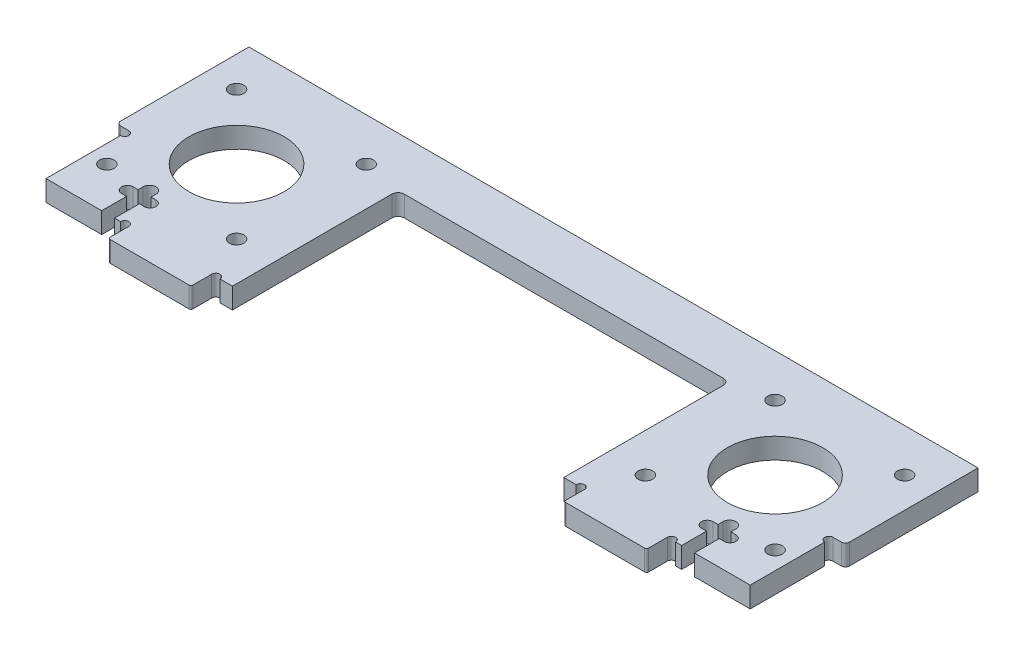
from build123d import *

# Parameters (mm, degrees)
SKETCH_1_W          = 170
SKETCH_1_H          = 52
EXTRUDE_1_DEPTH     = 5
SKETCH_2_R          = 11.5
SKETCH_2_R_2        = 1.75
CUT_EXTRUDE_1_DEPTH = 5
SKETCH_3_W          = 20
SKETCH_3_H          = 5
EXTRUDE_2_DEPTH     = 5
SKETCH_4_R          = 1
CUT_EXTRUDE_2_DEPTH = 5
CUT_EXTRUDE_3_DEPTH = 10
FILLET_1_R          = 0.5
SKETCH_7_W          = 3
SKETCH_7_H          = 32
EXTRUDE_3_DEPTH     = 5
SKETCH_8_R          = 1
CUT_EXTRUDE_5_DEPTH = 5
SKETCH_9_W          = 80
SKETCH_9_H          = 40
CUT_EXTRUDE_6_DEPTH = 10
FILLET_2_R          = 1.5
FILLET_3_R          = 1


with BuildPart() as part:
    # 스케치1 → 보스-돌출1 (new body)
    with BuildSketch(Plane(origin=(0, 0, 0), x_dir=(1, 0, 0), z_dir=(0, 1, 0))):
        with Locations((85, 26)):
            Rectangle(SKETCH_1_W, SKETCH_1_H)
    extrude(amount=EXTRUDE_1_DEPTH)

    # 스케치2 → 컷-돌출1 (cut)
    with BuildSketch(Plane(origin=(0, 5, 0), x_dir=(1, 0, 0), z_dir=(0, 1, 0))):
        with Locations(Location((150, 26, 0), (0, 0, 270))):
            Circle(SKETCH_2_R)
        with Locations(Location((165.65, 41.65, 0), (0, 0, 270))):
            Circle(SKETCH_2_R_2)
        with Locations(Location((134.35, 41.65, 0), (0, 0, 270))):
            Circle(SKETCH_2_R_2)
        with Locations(Location((165.65, 10.35, 0), (0, 0, 270))):
            Circle(SKETCH_2_R_2)
        with Locations(Location((134.35, 10.35, 0), (0, 0, 270))):
            Circle(SKETCH_2_R_2)
        with Locations(Location((35.65, 10.35, 0), (0, 0, 90))):
            Circle(SKETCH_2_R_2)
        with Locations(Location((4.35, 10.35, 0), (0, 0, 90))):
            Circle(SKETCH_2_R_2)
        with Locations(Location((35.65, 41.65, 0), (0, 0, 90))):
            Circle(SKETCH_2_R_2)
        with Locations(Location((4.35, 41.65, 0), (0, 0, 90))):
            Circle(SKETCH_2_R_2)
        with Locations(Location((20, 26, 0), (0, 0, 90))):
            Circle(SKETCH_2_R)
    extrude(amount=-CUT_EXTRUDE_1_DEPTH, mode=Mode.SUBTRACT)

    # 스케치3 → 보스-돌출2 (add)
    with BuildSketch(Plane(origin=(0, 5, 0), x_dir=(1, 0, 0), z_dir=(0, 1, 0))):
        with Locations((140, -2.5)):
            Rectangle(SKETCH_3_W, SKETCH_3_H)
        with Locations((30, -2.5)):
            Rectangle(SKETCH_3_W, SKETCH_3_H)
    extrude(amount=-EXTRUDE_2_DEPTH)

    # 스케치4 → 컷-돌출2 (cut)
    with BuildSketch(Plane(origin=(0, 5, 0), x_dir=(1, 0, 0), z_dir=(0, 1, 0))):
        with Locations((129, 0)):
            Circle(SKETCH_4_R)
        with Locations((151, 0)):
            Circle(SKETCH_4_R)
        with Locations((19, 0)):
            Circle(SKETCH_4_R)
        with Locations((41, 0)):
            Circle(SKETCH_4_R)
    extrude(amount=-CUT_EXTRUDE_2_DEPTH, mode=Mode.SUBTRACT)

    # 스케치5 → 컷-돌출3 (cut)
    with BuildSketch(Plane(origin=(0, 5, 0), x_dir=(1, 0, 0), z_dir=(0, 1, 0))):
        with BuildLine():
            Line((156.55, 0), (156.55, 6))
            Line((156.55, 6), (157.75, 6))
            ThreePointArc((157.75, 6), (159.15, 7.4), (157.75, 8.8))
            Line((157.75, 8.8), (156.55, 8.8))
            Line((156.55, 8.8), (156.55, 10))
            ThreePointArc((156.55, 10), (155, 11.55), (153.45, 10))
            Line((153.45, 10), (153.45, 8.8))
            Line((153.45, 8.8), (152.25, 8.8))
            ThreePointArc((152.25, 8.8), (150.85, 7.4), (152.25, 6))
            Line((152.25, 6), (153.45, 6))
            Line((153.45, 6), (153.45, 0))
            Line((153.45, 0), (156.55, 0))
        make_face()
        with BuildLine():
            Line((12.25, 6), (13.45, 6))
            Line((13.45, 6), (13.45, 0))
            Line((13.45, 0), (16.55, 0))
            Line((16.55, 0), (16.55, 6))
            Line((16.55, 6), (17.75, 6))
            ThreePointArc((17.75, 6), (19.15, 7.4), (17.75, 8.8))
            Line((17.75, 8.8), (16.55, 8.8))
            Line((16.55, 8.8), (16.55, 10))
            ThreePointArc((16.55, 10), (15, 11.55), (13.45, 10))
            Line((13.45, 10), (13.45, 8.8))
            Line((13.45, 8.8), (12.25, 8.8))
            ThreePointArc((12.25, 8.8), (10.85, 7.4), (12.25, 6))
        make_face()
    extrude(amount=-CUT_EXTRUDE_3_DEPTH, mode=Mode.SUBTRACT)

    # 필렛1
    fillet_1_edges = [part.edges().sort_by_distance(p)[0] for p in [
        (20, 2.5, 5),
        (130, 2.5, 5),
        (150, 2.5, 5),
        (40, 2.5, 5),
    ]]
    fillet(fillet_1_edges, radius=FILLET_1_R)

    # 스케치7 → 보스-돌출3 (add)
    with BuildSketch(Plane(origin=(0, 5, 0), x_dir=(1, 0, 0), z_dir=(0, 1, 0))):
        with Locations((171.5, 36)):
            Rectangle(SKETCH_7_W, SKETCH_7_H)
        with Locations((-1.5, 36)):
            Rectangle(SKETCH_7_W, SKETCH_7_H)
    extrude(amount=-EXTRUDE_3_DEPTH)

    # 스케치8 → 컷-돌출5 (cut)
    with BuildSketch(Plane(origin=(0, 5, 0), x_dir=(1, 0, 0), z_dir=(0, 1, 0))):
        with Locations((170, 19)):
            Circle(SKETCH_8_R)
        with Locations((0, 19)):
            Circle(SKETCH_8_R)
    extrude(amount=-CUT_EXTRUDE_5_DEPTH, mode=Mode.SUBTRACT)

    # 스케치9 → 컷-돌출6 (cut)
    with BuildSketch(Plane(origin=(0, 5, 0), x_dir=(1, 0, 0), z_dir=(0, 1, 0))):
        with Locations((85, 20)):
            Rectangle(SKETCH_9_W, SKETCH_9_H)
    extrude(amount=-CUT_EXTRUDE_6_DEPTH, mode=Mode.SUBTRACT)

    # 필렛2
    fillet_2_edges = [part.edges().sort_by_distance(p)[0] for p in [
        (125, 2.5, -40),
        (45, 2.5, -40),
    ]]
    fillet(fillet_2_edges, radius=FILLET_2_R)

    # 필렛3
    fillet_3_edges = [part.edges().sort_by_distance(p)[0] for p in [
        (173, 2.5, -20),
        (-3, 2.5, -20),
    ]]
    fillet(fillet_3_edges, radius=FILLET_3_R)


solid = part.part
